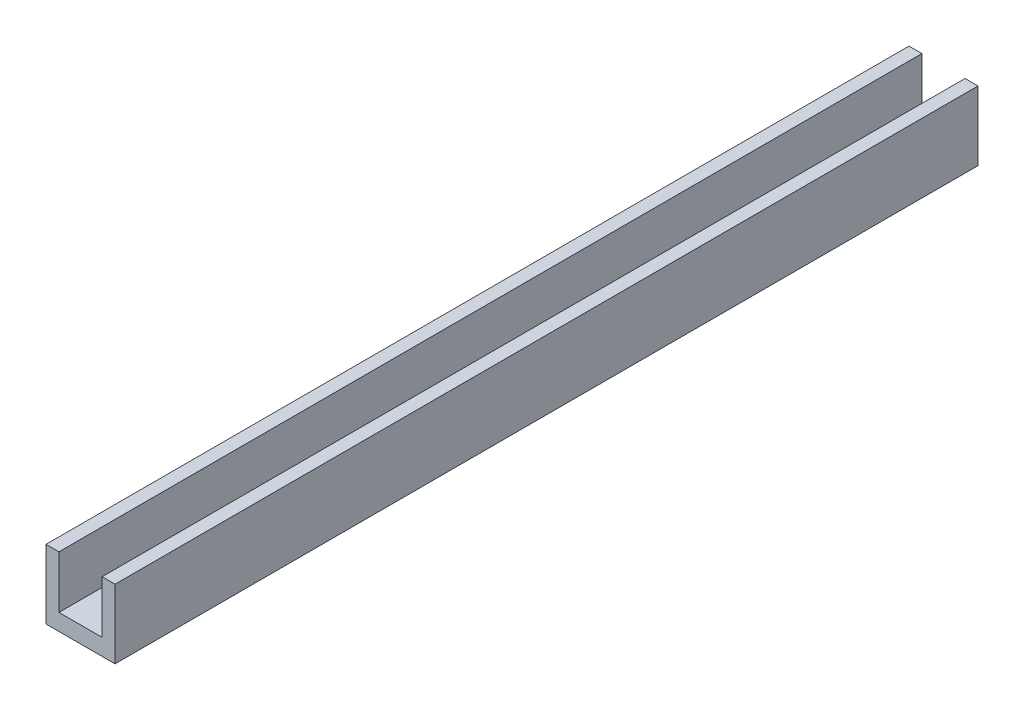
from build123d import *

# Parameters (mm, degrees)
SKETCH2_W           = 80
SKETCH2_H           = 80
BOSS_EXTRUDE1_DEPTH = 1000
SKETCH3_W           = 50
SKETCH3_H           = 60.834095989
CUT_EXTRUDE1_DEPTH  = 1000


with BuildPart() as part:
    # Sketch2 → Boss-Extrude1 (new body)
    with BuildSketch(Plane.XY):
        with Locations((40, 40)):
            Rectangle(SKETCH2_W, SKETCH2_H)
    extrude(amount=BOSS_EXTRUDE1_DEPTH)

    # Sketch3 → Cut-Extrude1 (cut)
    with BuildSketch(Plane.XY.offset(1000)):
        with Locations((40, 49.582952006)):
            Rectangle(SKETCH3_W, SKETCH3_H)
    extrude(amount=-CUT_EXTRUDE1_DEPTH, mode=Mode.SUBTRACT)


solid = part.part
